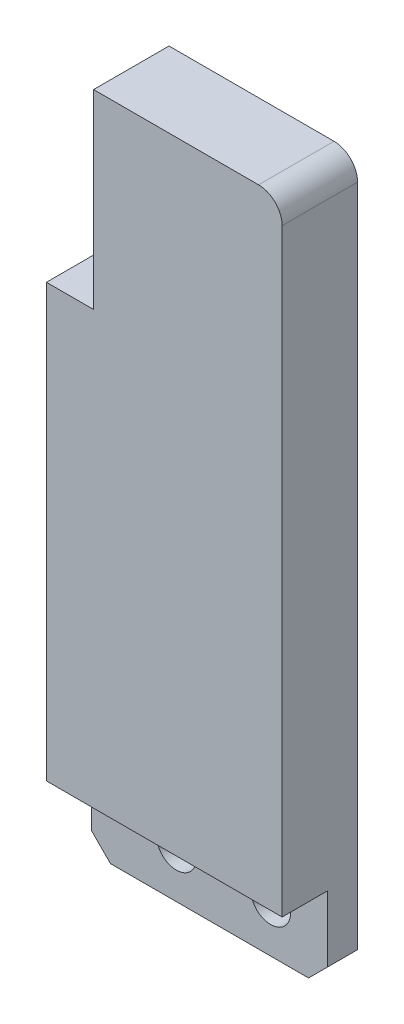
from build123d import *

# Parameters (mm, degrees)
SKETCH1_W                              = 25
SKETCH1_H                              = 75
BOSS_EXTRUDE1_DEPTH                    = 4
SKETCH2_W                              = 5
SKETCH2_H                              = 20.2
CUT_EXTRUDE1_DEPTH                     = 41.32988966
SKETCH3_W                              = 25
SKETCH3_H                              = 9
CUT_EXTRUDE2_DEPTH                     = 4.8
FILLET1_R                              = 2.5
CHAMFER1_SIZE                          = 2
TAPPED_HOLE_FOR_M4X0_7_HELICOIL1_D     = 4.2
TAPPED_HOLE_FOR_M4X0_7_HELICOIL1_DEPTH = 6.8
TAPPED_HOLE_FOR_M4X0_7_HELICOIL1_TIP   = 1.2618073
M4_CLEARANCE_HOLE1_D                   = 4.2


with BuildPart() as part:
    # Sketch1 → Boss-Extrude1 (new, symmetric)
    with BuildSketch(Plane.XY):
        Rectangle(SKETCH1_W, SKETCH1_H)
    extrude(amount=BOSS_EXTRUDE1_DEPTH, both=True)

    # Sketch2 → Cut-Extrude1 (cut, through all)
    with BuildSketch(Plane.XY.offset(4)):
        with Locations((-10, 27.4)):
            Rectangle(SKETCH2_W, SKETCH2_H)
    extrude(amount=-CUT_EXTRUDE1_DEPTH, mode=Mode.SUBTRACT)

    # Sketch3 → Cut-Extrude2 (cut)
    with BuildSketch(Plane.XY.offset(4)):
        with Locations((0, -33)):
            Rectangle(SKETCH3_W, SKETCH3_H)
    extrude(amount=-CUT_EXTRUDE2_DEPTH, mode=Mode.SUBTRACT)

    # Fillet1
    fillet1_edges = [part.edges().sort_by_distance(p)[0] for p in [
        (12.5, 37.5, 0),
    ]]
    fillet(fillet1_edges, radius=FILLET1_R)

    # Chamfer1
    chamfer1_edges = [part.edges().sort_by_distance(p)[0] for p in [
        (12.5, -37.5, -2.4),
        (-12.5, -37.5, -2.4),
    ]]
    chamfer(chamfer1_edges, length=CHAMFER1_SIZE)

    # Tapped Hole for M4x0.7 Helicoil1
    with Locations(Plane.ZY.offset(7.5)):
        with Locations((0, 22.5), (0, 32.5)):
            Hole(TAPPED_HOLE_FOR_M4X0_7_HELICOIL1_D / 2, depth=TAPPED_HOLE_FOR_M4X0_7_HELICOIL1_DEPTH)
            with Locations((0, 0, -(TAPPED_HOLE_FOR_M4X0_7_HELICOIL1_DEPTH + TAPPED_HOLE_FOR_M4X0_7_HELICOIL1_TIP / 2))):  # 118° drill point
                Cone(0, TAPPED_HOLE_FOR_M4X0_7_HELICOIL1_D / 2, TAPPED_HOLE_FOR_M4X0_7_HELICOIL1_TIP, mode=Mode.SUBTRACT)

    # M4 Clearance Hole1 (through all)
    with Locations(Plane(origin=(0, 0, -4), x_dir=(-1, 0, 0), z_dir=(0, 0, -1))):
        with Locations((-6.483, -32.5028), (3.517, -32.5028)):
            Hole(M4_CLEARANCE_HOLE1_D / 2)


solid = part.part
